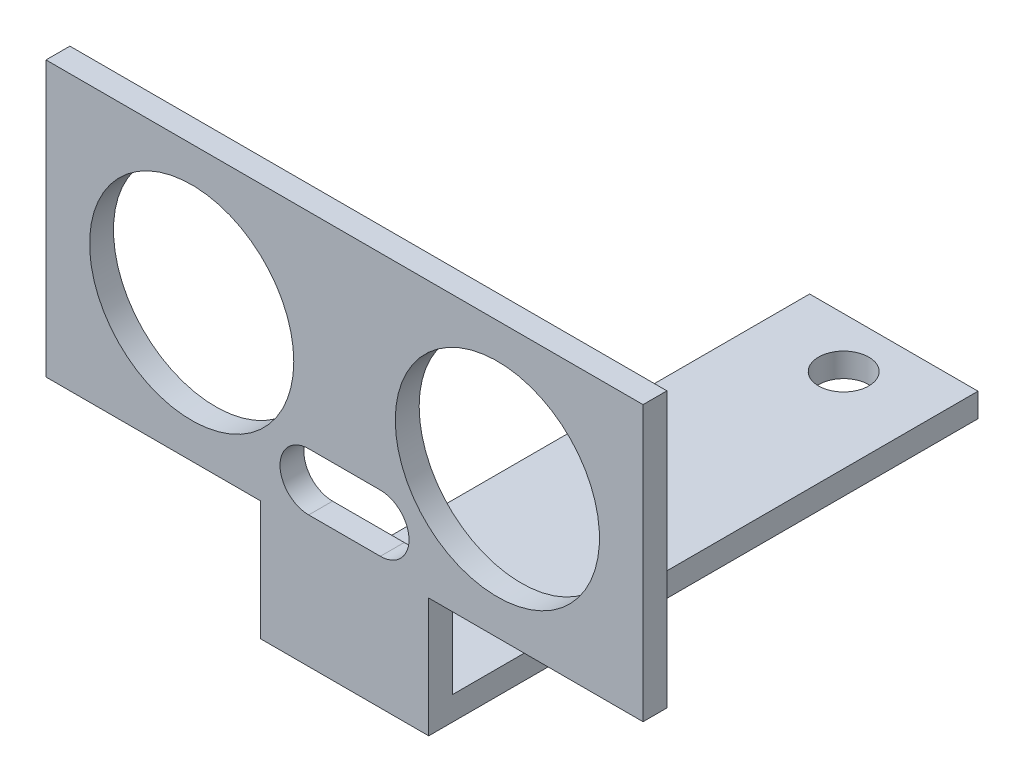
from build123d import *

# Parameters (mm, degrees)
BASEESB_W      = 14.1
BASEESB_H      = 46
BASE_DEPTH     = 2
FUROSFIXESB_R  = 2.1
FUROSFIX_DEPTH = 2
HOLDER_DEPTH   = 2
FUROSUSESB_R   = 8.55
FUROSUS_DEPTH  = 2


with BuildPart() as part:
    # baseEsb → base (new body)
    with BuildSketch(Plane(origin=(0, 0, 0), x_dir=(1, 0, 0), z_dir=(0, 1, 0))):
        with Locations((7.05, 23)):
            Rectangle(BASEESB_W, BASEESB_H)
    extrude(amount=BASE_DEPTH)

    # furosFixEsb → furosFix (cut)
    with BuildSketch(Plane(origin=(0, 2, 0), x_dir=(1, 0, 0), z_dir=(0, 1, 0))):
        with Locations(Location((7.05, 10.1, 0), (0, 0, 270))):
            Circle(FUROSFIXESB_R)
        with Locations(Location((7.05, 41.8, 0), (0, 0, 270))):
            Circle(FUROSFIXESB_R)
    extrude(amount=-FUROSFIX_DEPTH, mode=Mode.SUBTRACT)

    # holderEsb → holder (add)
    with BuildSketch(Plane.XY):
        Polygon((0, 0), (14.1, 0), (14.1, 10), (32.05, 10), (32.05, 33), (-17.95, 33), (-17.95, 10), (0, 10), align=None)
    extrude(amount=-HOLDER_DEPTH)

    # furosUSesb → furosUS (cut)
    with BuildSketch(Plane.XY):
        with Locations((-5.75, 21.5)):
            Circle(FUROSUSESB_R)
        with Locations(Location((19.85, 21.5, 0), (0, 0, 180))):
            Circle(FUROSUSESB_R)
        with BuildLine():
            Line((4.05, 15.8), (10.05, 15.8))
            ThreePointArc((10.05, 15.8), (12.45, 13.4), (10.05, 11))
            Line((10.05, 11), (4.05, 11))
            ThreePointArc((4.05, 11), (1.65, 13.4), (4.05, 15.8))
        make_face()
    extrude(amount=-FUROSUS_DEPTH, mode=Mode.SUBTRACT)


solid = part.part
